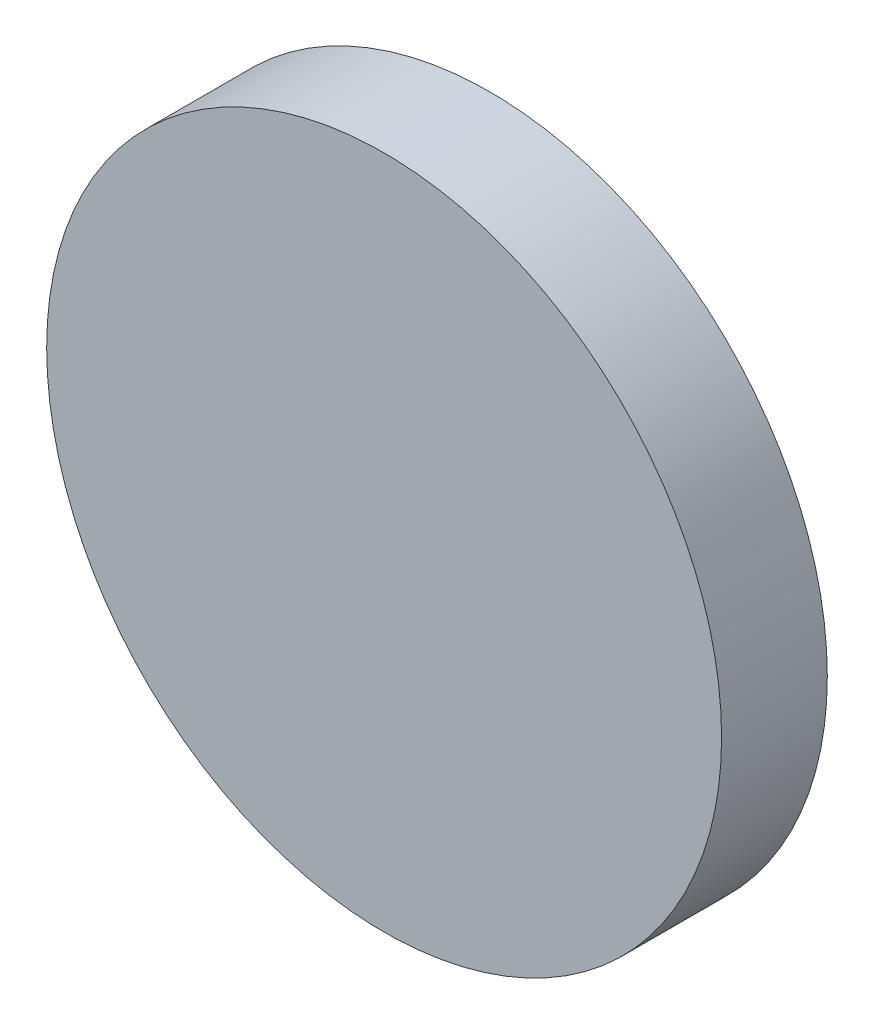
from build123d import *

# Parameters (mm, degrees)
ESQUISSE1_R        = 15
BOSS_EXTRU_1_DEPTH = 4.7


with BuildPart() as part:
    # Esquisse1 → Boss.-Extru.1 (new body)
    with BuildSketch(Plane.XY):
        Circle(ESQUISSE1_R)
    extrude(amount=BOSS_EXTRU_1_DEPTH)


solid = part.part
